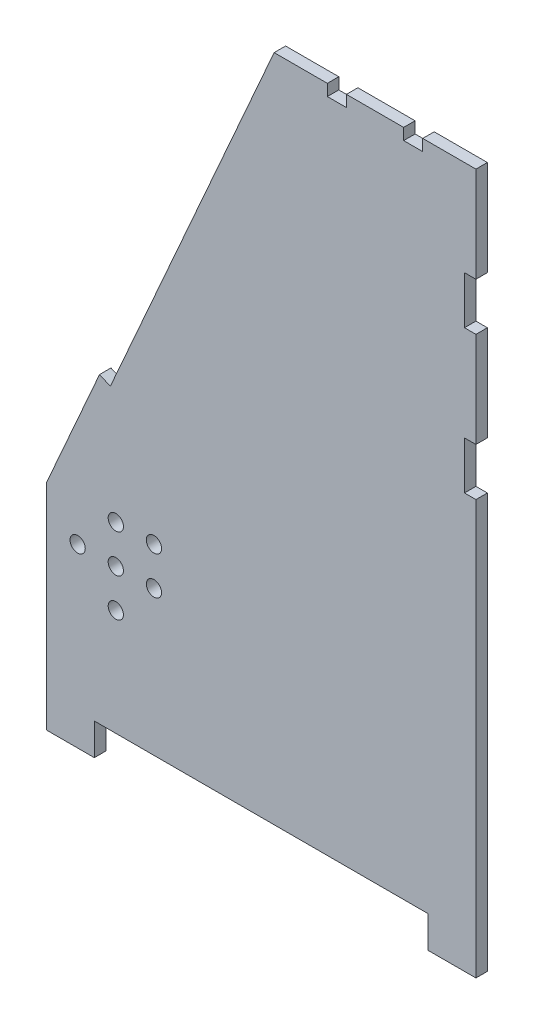
from build123d import *

# Parameters (mm, degrees)
SKETCH1_R           = 1.6
BOSS_EXTRUDE1_DEPTH = 2.4


with BuildPart() as part:
    # Sketch1 → Boss-Extrude1 (new body)
    with BuildSketch(Plane.XY):
        Polygon((-45, 15), (-45, 0), (-45, -30), (-35, -30), (-35, -23.333333333), (35, -23.333333333), (35, -30), (45, -30), (45, 56.864530178), (42.6, 56.864530178), (42.6, 66.864530178), (45, 66.864530178), (45, 86.864530178), (42.6, 86.864530178), (42.6, 96.864530178), (45, 96.864530178), (45, 116.864530178), (33.85, 116.864530178), (33.85, 114.464530178), (29.85, 114.464530178), (29.85, 116.864530178), (17.85, 116.864530178), (17.85, 114.464530178), (13.85, 114.464530178), (13.85, 116.864530178), (2.7, 116.864530178), (-31.647599314, 39.113373136), (-33.906721049, 40.111369965), align=None)
        with Locations((-30.5, -1)):
            Circle(SKETCH1_R, mode=Mode.SUBTRACT)
        with Locations((-38.5, 7)):
            Circle(SKETCH1_R, mode=Mode.SUBTRACT)
        with Locations((-30.5, 7)):
            Circle(SKETCH1_R, mode=Mode.SUBTRACT)
        with Locations((-22.5, 7)):
            Circle(SKETCH1_R, mode=Mode.SUBTRACT)
        with Locations((-30.5, 15)):
            Circle(SKETCH1_R, mode=Mode.SUBTRACT)
        with Locations((-22.5, 15)):
            Circle(SKETCH1_R, mode=Mode.SUBTRACT)
    extrude(amount=BOSS_EXTRUDE1_DEPTH)


solid = part.part
